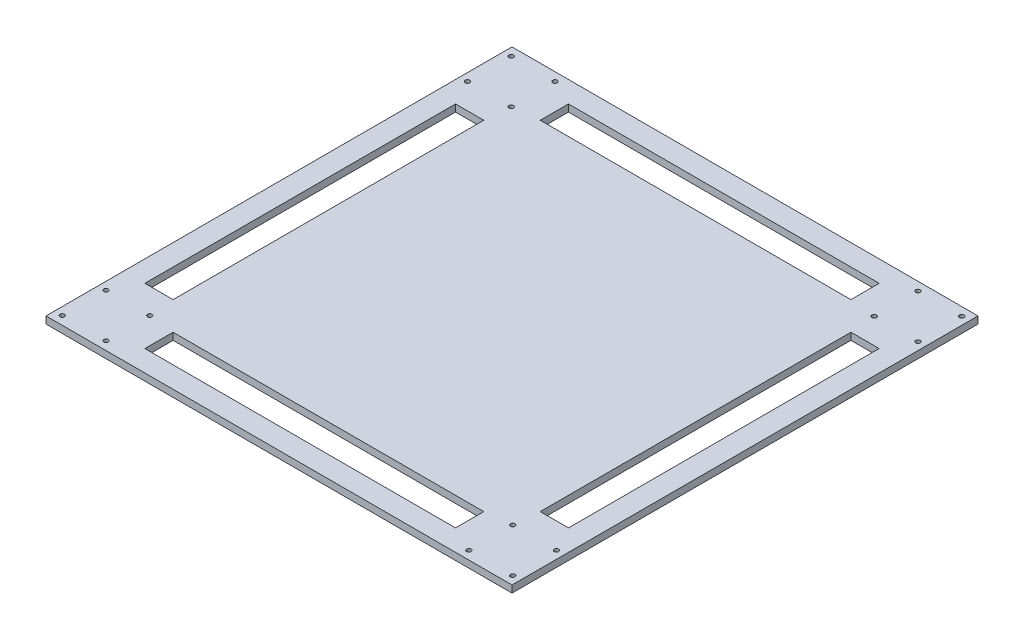
from build123d import *

# Parameters (mm, degrees)
SKETCH_1_W          = 330
SKETCH_1_H          = 330
EXTRUDE_1_DEPTH     = 5
SKETCH_2_R          = 1.6
SKETCH_2_R_2        = 1.602203763
CUT_EXTRUDE_1_DEPTH = 234.39880034
SKETCH_3_W          = 220
SKETCH_3_H          = 20
CUT_EXTRUDE_2_DEPTH = 234.39880034
SKETCH_4_W          = 20
SKETCH_4_H          = 220
CUT_EXTRUDE_3_DEPTH = 234.39880034
SKETCH_7_W          = 220
SKETCH_7_H          = 20
CUT_EXTRUDE_4_DEPTH = 234.39880034
SKETCH_9_W          = 239.54111937
SKETCH_9_H          = 233.56752537
EXTRUDE_2_DEPTH     = 5


with BuildPart() as part:
    # 草图1 → 凸台-拉伸1 (new body)
    with BuildSketch(Plane(origin=(0, 0, 0), x_dir=(1, 0, 0), z_dir=(0, 1, 0))):
        Rectangle(SKETCH_1_W, SKETCH_1_H)
    extrude(amount=EXTRUDE_1_DEPTH)

    # 草图2 → 切除-拉伸1 (cut, through all)
    with BuildSketch(Plane(origin=(0, 5, 0), x_dir=(1, 0, 0), z_dir=(0, 1, 0))):
        with Locations(Location((-159.5, 159, 0), (0, 0, 270))):
            Circle(SKETCH_2_R)
        with Locations(Location((-128.5, 159, 0), (0, 0, 270))):
            Circle(SKETCH_2_R)
        with Locations(Location((-159.5, 128, 0), (0, 0, 270))):
            Circle(SKETCH_2_R_2)
        with Locations(Location((-128.5, 128, 0), (0, 0, 270))):
            Circle(SKETCH_2_R)
        with Locations(Location((128.5, 159, 0), (0, 0, 270))):
            Circle(SKETCH_2_R)
        with Locations(Location((159.5, 159, 0), (0, 0, 270))):
            Circle(SKETCH_2_R)
        with Locations(Location((128.5, 128, 0), (0, 0, 270))):
            Circle(SKETCH_2_R)
        with Locations(Location((159.5, 128, 0), (0, 0, 270))):
            Circle(SKETCH_2_R)
        with Locations(Location((128.5, -128, 0), (0, 0, 270))):
            Circle(SKETCH_2_R)
        with Locations(Location((159.5, -128, 0), (0, 0, 270))):
            Circle(SKETCH_2_R)
        with Locations(Location((159.5, -159, 0), (0, 0, 270))):
            Circle(SKETCH_2_R)
        with Locations(Location((128.5, -159, 0), (0, 0, 270))):
            Circle(SKETCH_2_R)
        with Locations(Location((-128.5, -159, 0), (0, 0, 270))):
            Circle(SKETCH_2_R)
        with Locations(Location((-159.5, -159, 0), (0, 0, 270))):
            Circle(SKETCH_2_R)
        with Locations(Location((-159.5, -128, 0), (0, 0, 270))):
            Circle(SKETCH_2_R)
        with Locations(Location((-128.5, -128, 0), (0, 0, 270))):
            Circle(SKETCH_2_R)
    extrude(amount=-CUT_EXTRUDE_1_DEPTH, mode=Mode.SUBTRACT)

    # 草图3 → 切除-拉伸2 (cut, through all)
    with BuildSketch(Plane(origin=(0, 5, 0), x_dir=(1, 0, 0), z_dir=(0, 1, 0))):
        with Locations((0, 100)):
            Rectangle(SKETCH_3_W, SKETCH_3_H)
        with Locations((0, 50)):
            Rectangle(SKETCH_3_W, SKETCH_3_H)
        Rectangle(SKETCH_3_W, SKETCH_3_H)
        with Locations((0, -50)):
            Rectangle(SKETCH_3_W, SKETCH_3_H)
        with Locations((0, -100)):
            Rectangle(SKETCH_3_W, SKETCH_3_H)
    extrude(amount=-CUT_EXTRUDE_2_DEPTH, mode=Mode.SUBTRACT)

    # 草图4 → 切除-拉伸3 (cut, through all)
    with BuildSketch(Plane(origin=(0, 5, 0), x_dir=(1, 0, 0), z_dir=(0, 1, 0))):
        with Locations((-140, 0)):
            Rectangle(SKETCH_4_W, SKETCH_4_H)
        with Locations((140, 0)):
            Rectangle(SKETCH_4_W, SKETCH_4_H)
    extrude(amount=-CUT_EXTRUDE_3_DEPTH, mode=Mode.SUBTRACT)

    # 草图7 → 切除-拉伸4 (cut, through all)
    with BuildSketch(Plane(origin=(0, 5, 0), x_dir=(1, 0, 0), z_dir=(0, 1, 0))):
        with Locations((0, 140)):
            Rectangle(SKETCH_7_W, SKETCH_7_H)
        with Locations((0, -140)):
            Rectangle(SKETCH_7_W, SKETCH_7_H)
    extrude(amount=-CUT_EXTRUDE_4_DEPTH, mode=Mode.SUBTRACT)

    # 草图9 → 凸台-拉伸2 (add)
    with BuildSketch(Plane(origin=(0, 5, 0), x_dir=(1, 0, 0), z_dir=(0, 1, 0))):
        with Locations((2.0907579, 0.2986797)):
            Rectangle(SKETCH_9_W, SKETCH_9_H)
    extrude(amount=-EXTRUDE_2_DEPTH)


solid = part.part
